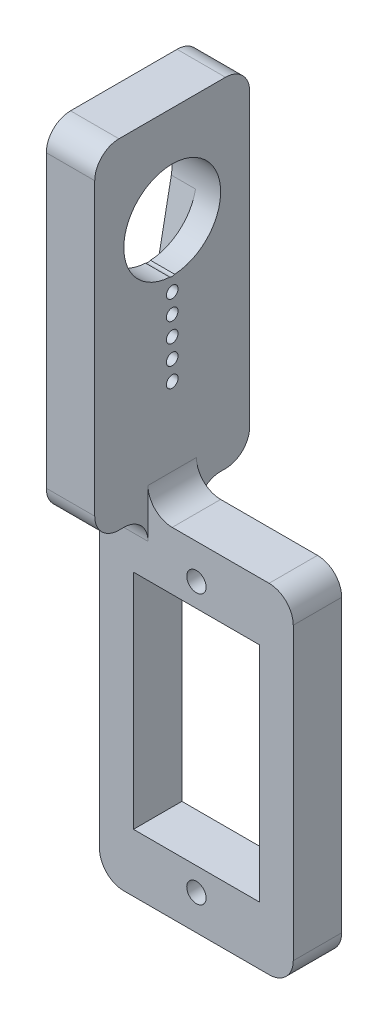
from build123d import *

# Parameters (mm, degrees)
SKETCH1_W           = 20
SKETCH1_H           = 35
SKETCH1_W_2         = 13
SKETCH1_H_2         = 23
BOSS_EXTRUDE1_DEPTH = 5
SKETCH2_R           = 1
CUT_EXTRUDE1_DEPTH  = 5
BOSS_EXTRUDE2_DEPTH = 5
FILLET1_R           = 2.5
SKETCH5_R           = 5
CUT_EXTRUDE2_DEPTH  = 5
SKETCH6_R           = 0.6
CUT_EXTRUDE3_DEPTH  = 5
CUT_EXTRUDE4_START  = -2.5
SKETCH8_R           = 0.6
SKETCH8_R_2         = 2.25
CUT_EXTRUDE4_DEPTH  = 2.5
FILLET2_R           = 2.5


with BuildPart() as part:
    # Sketch1 → Boss-Extrude1 (new body)
    with BuildSketch(Plane.XY):
        Rectangle(SKETCH1_W, SKETCH1_H)
        Rectangle(SKETCH1_W_2, SKETCH1_H_2, mode=Mode.SUBTRACT)
    extrude(amount=BOSS_EXTRUDE1_DEPTH)

    # Sketch2 → Cut-Extrude1 (cut)
    with BuildSketch(Plane.XY.offset(5)):
        with Locations((0, 13.9)):
            Circle(SKETCH2_R)
        with Locations(Location((0, -13.9, 0), (0, 0, 180))):
            Circle(SKETCH2_R)
    extrude(amount=-CUT_EXTRUDE1_DEPTH, mode=Mode.SUBTRACT)

    # Sketch3 → Boss-Extrude2 (add)
    with BuildSketch(Plane.ZY.offset(10)):
        Polygon((-5.5, 52.5), (-5.5, 17.5), (0, 17.5), (2.5, 17.5), (2.5, 52.5), align=None)
        Polygon((2.5, 52.5), (2.5, 17.5), (5, 17.5), (10.5, 17.5), (10.5, 52.5), align=None)
    extrude(amount=-BOSS_EXTRUDE2_DEPTH)

    # Fillet1
    fillet1_edges = [part.edges().sort_by_distance(p)[0] for p in [
        (-7.5, 17.5, 0),
        (-7.5, 17.5, 5),
    ]]
    fillet(fillet1_edges, radius=FILLET1_R)

    # Sketch5 → Cut-Extrude2 (cut)
    with BuildSketch(Plane(origin=(-5, 0, 0), x_dir=(0, 0, -1), z_dir=(1, 0, 0))):
        with Locations((-2.5, 42.5)):
            Circle(SKETCH5_R)
    extrude(amount=-CUT_EXTRUDE2_DEPTH, mode=Mode.SUBTRACT)

    # Sketch6 → Cut-Extrude3 (cut)
    with BuildSketch(Plane.ZY.offset(10)):
        with Locations((2.5, 38.05)):
            Circle(SKETCH6_R)
        with Locations((2.5, 36.05)):
            Circle(SKETCH6_R)
        with Locations((2.5, 34.05)):
            Circle(SKETCH6_R)
        with Locations((2.5, 32.05)):
            Circle(SKETCH6_R)
        with Locations((2.5, 30.05)):
            Circle(SKETCH6_R)
        with Locations((2.5, 28.05)):
            Circle(SKETCH6_R)
    extrude(amount=-CUT_EXTRUDE3_DEPTH, mode=Mode.SUBTRACT)

    # Sketch8 → Cut-Extrude4 (cut)
    # profile 1 of 4: a face of its own
    with BuildSketch(Plane.ZY.offset(10).offset(CUT_EXTRUDE4_START)):
        with BuildLine():
            ThreePointArc((2.245903559, 37.506460674), (-0.77838564, 38.72479304), (-2.408618858, 41.548442907))
            Line((-2.408618858, 41.548442907), (0.291121514, 27.621799308))
            ThreePointArc((0.291121514, 27.621799308), (0.594562485, 29.246581747), (1.926278936, 30.225625))
            ThreePointArc((1.926278936, 30.225625), (2.5, 30.65), (3.073721064, 30.225625))
            ThreePointArc((3.073721064, 30.225625), (4.282326064, 29.423249359), (4.75, 28.05))
            ThreePointArc((4.75, 28.05), (4.739696028, 27.834914661), (4.708878486, 27.621799308))
            Line((4.708878486, 27.621799308), (7.408618858, 41.548442907))
            ThreePointArc((7.408618858, 41.548442907), (5.77838564, 38.72479304), (2.754096441, 37.506460674))
            ThreePointArc((2.754096441, 37.506460674), (2.5, 37.45), (2.245903559, 37.506460674))
        make_face()
        with Locations((2.5, 32.05)):
            Circle(SKETCH8_R, mode=Mode.SUBTRACT)
        with Locations((2.5, 34.05)):
            Circle(SKETCH8_R, mode=Mode.SUBTRACT)
        with Locations((2.5, 36.05)):
            Circle(SKETCH8_R, mode=Mode.SUBTRACT)
    # profile 2 of 4: a face of its own
    with BuildSketch(Plane.ZY.offset(10).offset(CUT_EXTRUDE4_START)):
        with Locations((2.5, 28.05)):
            Circle(SKETCH8_R_2)
        with Locations((2.5, 28.05)):
            Circle(SKETCH8_R, mode=Mode.SUBTRACT)
    # profile 3 of 4: a face of its own
    with BuildSketch(Plane.ZY.offset(10).offset(CUT_EXTRUDE4_START)):
        with Locations((2.5, 30.05)):
            Circle(SKETCH8_R)
    # profile 4 of 4: a face of its own
    with BuildSketch(Plane.ZY.offset(10).offset(CUT_EXTRUDE4_START)):
        with BuildLine():
            ThreePointArc((7.5, 42.5), (2.022032581, 47.477102284), (-2.408618858, 41.548442907))
            ThreePointArc((-2.408618858, 41.548442907), (-0.77838564, 38.72479304), (2.245903559, 37.506460674))
            ThreePointArc((2.245903559, 37.506460674), (2.5, 37.5), (2.754096441, 37.506460674))
            ThreePointArc((2.754096441, 37.506460674), (5.77838564, 38.72479304), (7.408618858, 41.548442907))
            ThreePointArc((7.408618858, 41.548442907), (7.477102284, 42.022032581), (7.5, 42.5))
        make_face()
    extrude(amount=CUT_EXTRUDE4_DEPTH, mode=Mode.SUBTRACT)

    # Fillet2
    fillet2_edges = [part.edges().sort_by_distance(p)[0] for p in [
        (-10, -17.5, 2.5),
        (-5, 17.5, 2.5),
        (10, 17.5, 2.5),
        (10, -17.5, 2.5),
        (-7.5, 17.5, 10.5),
        (-7.5, 52.5, 10.5),
        (-7.5, 52.5, -5.5),
        (-7.5, 17.5, -5.5),
    ]]
    fillet(fillet2_edges, radius=FILLET2_R)


solid = part.part
